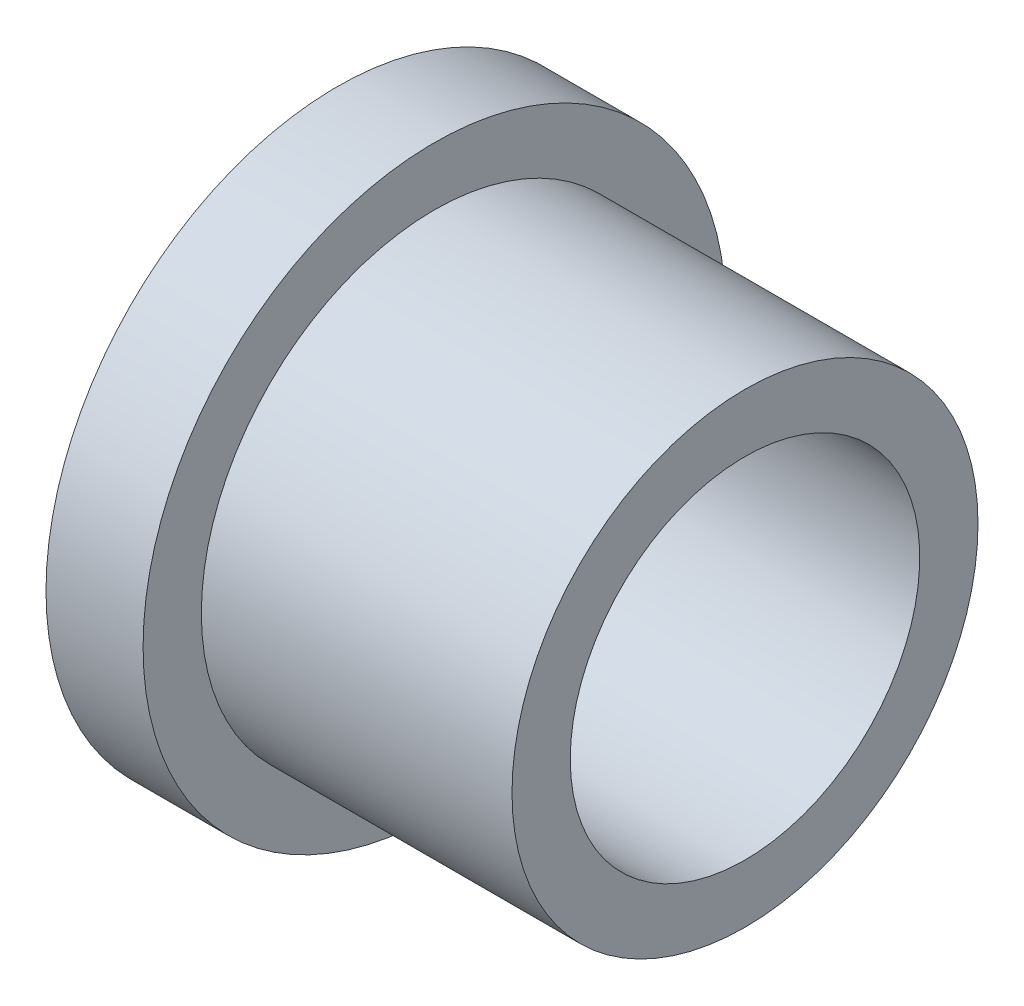
from build123d import *


with BuildPart() as part:
    # Sketch1 → Revolve1 (revolve)
    with BuildSketch(Plane.XY, mode=Mode.PRIVATE) as revolve1_sk:
        Polygon((0, 15), (0, 9), (21, 9), (21, 12), (5, 12), (5, 15), align=None)
    revolve(revolve1_sk.sketch.rotate(Axis((0, 0, 0), (1, 0, 0)), 90), axis=Axis((0, 0, 0), (1, 0, 0)))


solid = part.part
